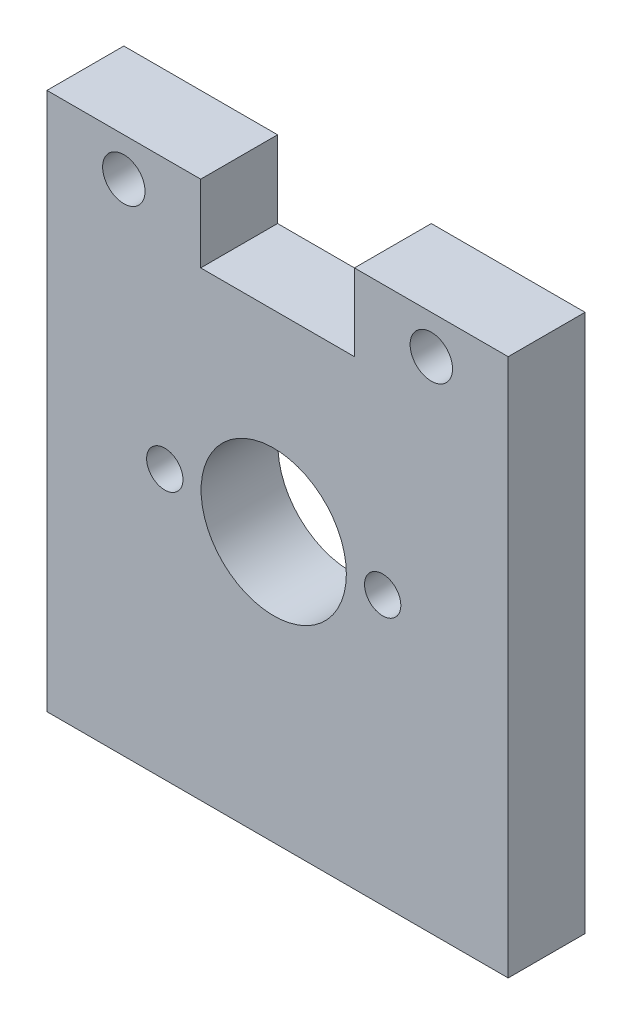
from build123d import *

# Parameters (mm, degrees)
SKETCH1_W             = 38.1
SKETCH1_H             = 44.45
BOSS_EXTRUDE1_DEPTH   = 3.175
F_6_CLEARANCE_HOLE1_D = 3.5052
CUT_EXTRUDE3_REACH    = 60.887
SKETCH6_W             = 12.7
SKETCH6_H             = 6.35
CUT_EXTRUDE4_REACH    = 60.887
SKETCH7_R             = 6
M3_CLEARANCE_HOLE1_D  = 3


with BuildPart() as part:
    # Sketch1 → Boss-Extrude1 (new, symmetric)
    with BuildSketch(Plane.XY):
        with Locations((19.05, -22.225)):
            Rectangle(SKETCH1_W, SKETCH1_H)
    extrude(amount=BOSS_EXTRUDE1_DEPTH, both=True)

    # #6 Clearance Hole1 (through all)
    with Locations(Plane.XY.offset(3.175)):
        with Locations((6.35, -3.175), (31.75, -3.175)):
            Hole(F_6_CLEARANCE_HOLE1_D / 2)

    # Sketch6 → Cut-Extrude3 (cut, up to next)
    with BuildSketch(Plane.XY.offset(3.175), mode=Mode.PRIVATE) as cut_extrude3_sk1:
        with Locations((19.05, -3.175)):
            Rectangle(SKETCH6_W, SKETCH6_H)
    cut_extrude3_tool1 = extrude(cut_extrude3_sk1.sketch, amount=-CUT_EXTRUDE3_REACH, mode=Mode.PRIVATE) & part.part
    add(cut_extrude3_tool1.solids().sort_by_distance((19.05, -3.175, 3.175))[0], mode=Mode.SUBTRACT)

    # Sketch7 → Cut-Extrude4 (cut, up to next)
    with BuildSketch(Plane.XY.offset(3.175), mode=Mode.PRIVATE) as cut_extrude4_sk1:
        with Locations((18.7325, -22.225)):
            Circle(SKETCH7_R)
    cut_extrude4_tool1 = extrude(cut_extrude4_sk1.sketch, amount=-CUT_EXTRUDE4_REACH, mode=Mode.PRIVATE) & part.part
    add(cut_extrude4_tool1.solids().sort_by_distance((18.7325, -22.225, 3.175))[0], mode=Mode.SUBTRACT)

    # M3 Clearance Hole1 (through all)
    with Locations(Plane.XY.offset(3.175)):
        with Locations((27.7325, -22.225), (9.7325, -22.225)):
            Hole(M3_CLEARANCE_HOLE1_D / 2)


solid = part.part
